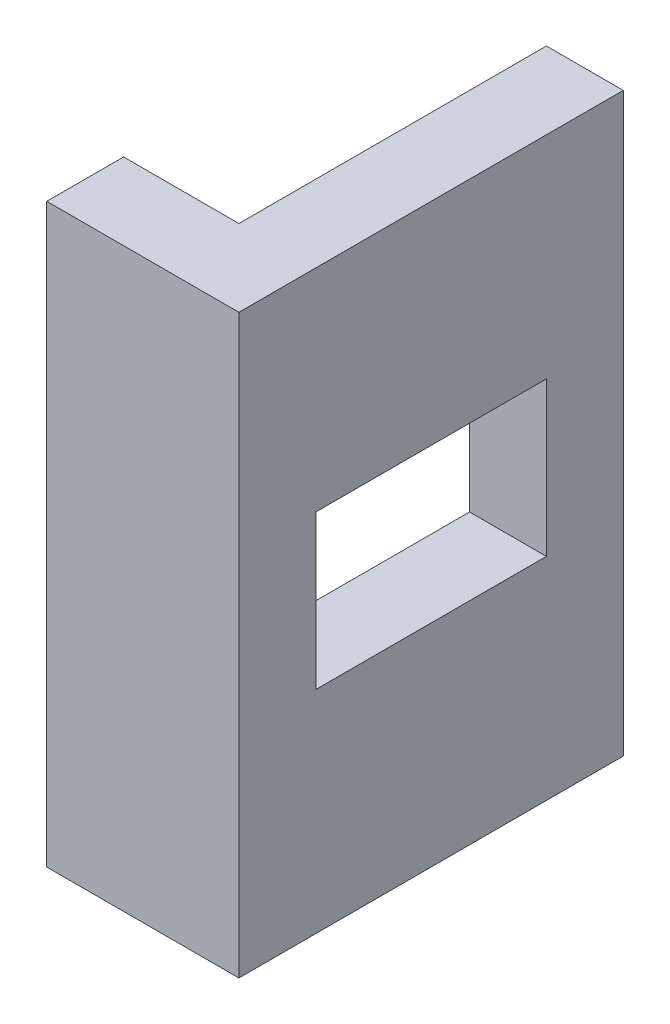
from build123d import *

# Parameters (mm, degrees)
SKETCH1_W           = 5
SKETCH1_H           = 15
BOSS_EXTRUDE1_DEPTH = 5
SKETCH4_W           = 3
SKETCH4_H           = 8
CUT_EXTRUDE3_DEPTH  = 15
SKETCH5_W           = 6
SKETCH5_H           = 4
CUT_EXTRUDE5_DEPTH  = 2


with BuildPart() as part:
    # Sketch1 → Boss-Extrude1 (new, symmetric)
    with BuildSketch(Plane.XY):
        Rectangle(SKETCH1_W, SKETCH1_H)
    extrude(amount=BOSS_EXTRUDE1_DEPTH, both=True)

    # Sketch4 → Cut-Extrude3 (cut)
    with BuildSketch(Plane(origin=(0, 7.5, 0), x_dir=(1, 0, 0), z_dir=(0, 1, 0))):
        with Locations((-1, 1)):
            Rectangle(SKETCH4_W, SKETCH4_H)
    extrude(amount=-CUT_EXTRUDE3_DEPTH, mode=Mode.SUBTRACT)

    # Sketch5 → Cut-Extrude5 (cut)
    with BuildSketch(Plane.ZY.offset(-0.5)):
        Rectangle(SKETCH5_W, SKETCH5_H)
    extrude(amount=-CUT_EXTRUDE5_DEPTH, mode=Mode.SUBTRACT)


solid = part.part
